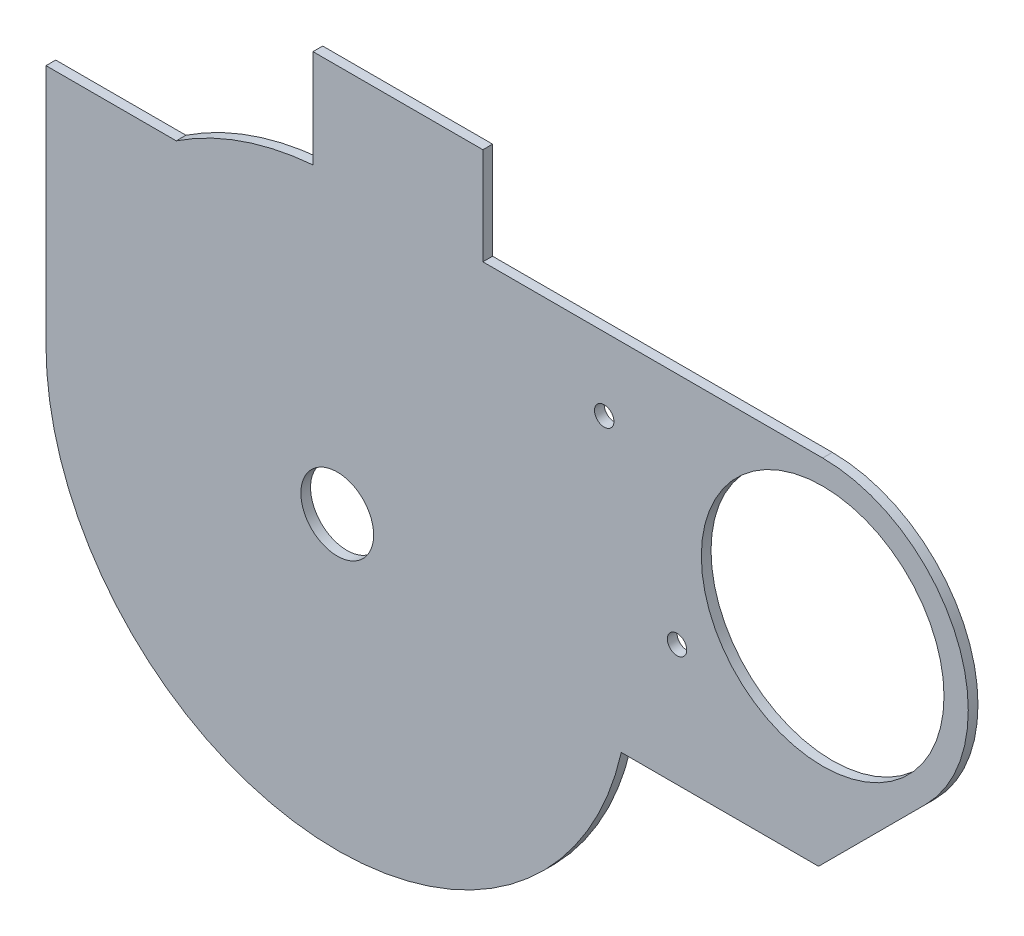
from build123d import *

# Parameters (mm, degrees)
SKETCH1_R           = 7.5
SKETCH1_R_2         = 25
BOSS_EXTRUDE1_DEPTH = 2
CUT_EXTRUDE1_REACH  = 145.192
SKETCH2_R           = 2
BOSS_EXTRUDE2_DEPTH = 2
SKETCH4_W           = 2
SKETCH4_H           = 6.5
SKETCH4_W_2         = 6.5
SKETCH4_H_2         = 2
BOSS_EXTRUDE3_DEPTH = 1


with BuildPart() as part:
    # Sketch1 → Boss-Extrude1 (new body)
    # profile 1 of 2: a face of its own
    with BuildSketch(Plane.XY):
        with BuildLine():
            ThreePointArc((-60, 0), (-52.867640737, 28.372743309), (-33.166247904, 50))
            Line((-33.166247904, 50), (-60, 50))
            Line((-60, 50), (-60, 0))
        make_face()
    # profile 2 of 2: a face of its own
    with BuildSketch(Plane.XY):
        with BuildLine():
            ThreePointArc((0, 60), (-17.320508076, 57.445626465), (-33.166247904, 50))
            ThreePointArc((-33.166247904, 50), (-52.867640737, 28.372743309), (-60, 0))
            ThreePointArc((-60, 0), (-6.678621673, -59.627141576), (58.513200418, -13.274237334))
            Line((58.513200418, -13.274237334), (99.152169538, -13.274237334))
            Line((99.152169538, -13.274237334), (121.213203436, 8.786796564))
            ThreePointArc((121.213203436, 8.786796564), (127.716385975, 41.480502971), (100, 60))
            Line((100, 60), (0, 60))
        make_face()
        Circle(SKETCH1_R, mode=Mode.SUBTRACT)
        with Locations((100, 30)):
            Circle(SKETCH1_R_2, mode=Mode.SUBTRACT)
    extrude(amount=BOSS_EXTRUDE1_DEPTH)

    # Sketch2 → Cut-Extrude1 (cut, up to next)
    with BuildSketch(Plane.XY.offset(2), mode=Mode.PRIVATE) as cut_extrude1_sk1:
        with Locations((55, 45)):
            Circle(SKETCH2_R)
    cut_extrude1_tool1 = extrude(cut_extrude1_sk1.sketch, amount=-CUT_EXTRUDE1_REACH, mode=Mode.PRIVATE) & part.part
    # Sketch2 → Cut-Extrude1 (cut, up to next)
    with BuildSketch(Plane.XY.offset(2), mode=Mode.PRIVATE) as cut_extrude1_sk2:
        with Locations((70, 11.725762666)):
            Circle(SKETCH2_R)
    cut_extrude1_tool2 = extrude(cut_extrude1_sk2.sketch, amount=-CUT_EXTRUDE1_REACH, mode=Mode.PRIVATE) & part.part
    add(cut_extrude1_tool1.solids().sort_by_distance((55, 45, 2))[0], mode=Mode.SUBTRACT)
    add(cut_extrude1_tool2.solids().sort_by_distance((70, 11.725763, 2))[0], mode=Mode.SUBTRACT)

    # Sketch3 → Boss-Extrude2 (add)
    with BuildSketch(Plane(origin=(0, 0, 0), x_dir=(-1, 0, 0), z_dir=(0, 0, -1))):
        with BuildLine():
            Line((-30, 80), (-30, 60))
            Line((-30, 60), (0, 60))
            ThreePointArc((0, 60), (2.502176759, 59.947803225), (5, 59.791303715))
            Line((5, 59.791303715), (5, 80))
            Line((5, 80), (-30, 80))
        make_face()
    extrude(amount=-BOSS_EXTRUDE2_DEPTH)

    # Sketch4 → Boss-Extrude3 (add)
    with BuildSketch(Plane(origin=(0, 0, 0), x_dir=(-1, 0, 0), z_dir=(0, 0, -1))):
        with Locations((-12.5, 68.846087829)):
            Rectangle(SKETCH4_W, SKETCH4_H)
        with Locations((-16.75, 64.596087829)):
            Rectangle(SKETCH4_W_2, SKETCH4_H_2)
        with Locations((-12.5, 64.596087829)):
            Rectangle(SKETCH4_W, SKETCH4_H_2)
        with Locations((-8.25, 64.596087829)):
            Rectangle(SKETCH4_W_2, SKETCH4_H_2)
        with Locations((-12.5, 60.346087829)):
            Rectangle(SKETCH4_W, SKETCH4_H)
    extrude(amount=BOSS_EXTRUDE3_DEPTH)


solid = part.part
